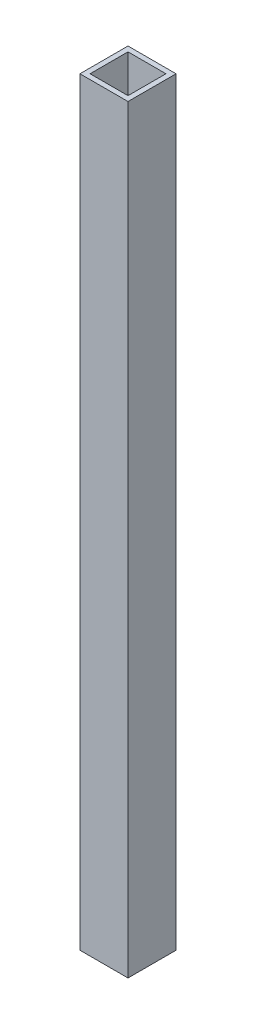
from build123d import *

# Parameters (mm, degrees)
SKETCH1_W           = 19
SKETCH1_H           = 19
SKETCH1_W_2         = 15
SKETCH1_H_2         = 15
BOSS_EXTRUDE1_DEPTH = 300


with BuildPart() as part:
    # Sketch1 → Boss-Extrude1 (new body)
    with BuildSketch(Plane(origin=(0, 0, 0), x_dir=(1, 0, 0), z_dir=(0, 1, 0))):
        Rectangle(SKETCH1_W, SKETCH1_H)
        Rectangle(SKETCH1_W_2, SKETCH1_H_2, mode=Mode.SUBTRACT)
    extrude(amount=BOSS_EXTRUDE1_DEPTH)


solid = part.part
